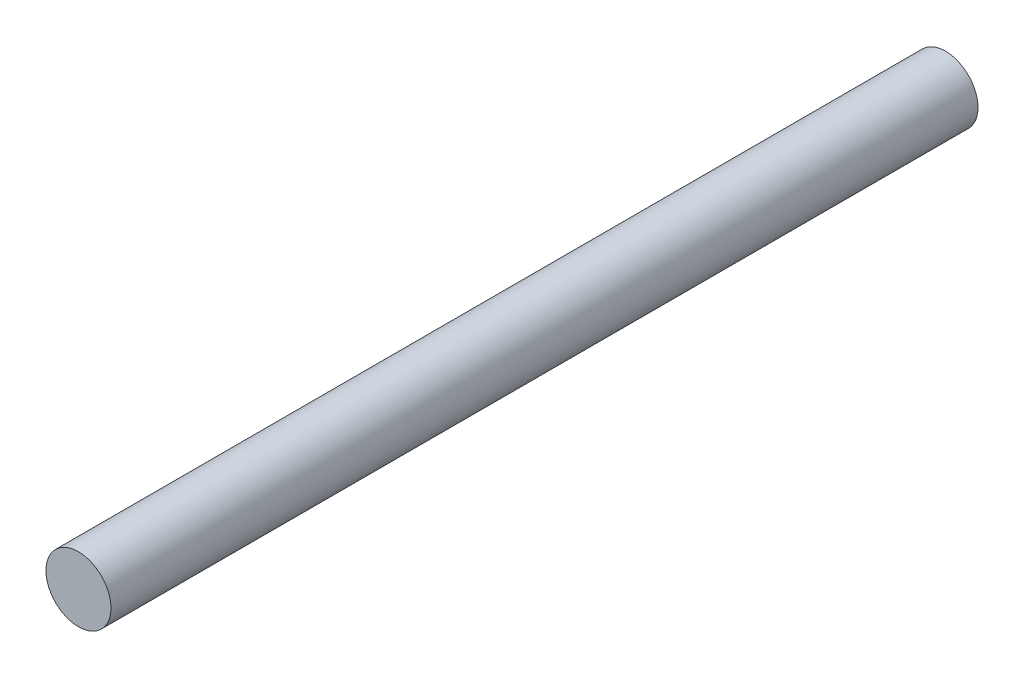
from build123d import *

# Parameters (mm, degrees)
SKETCH1_R           = 7.5
BOSS_EXTRUDE1_DEPTH = 200


with BuildPart() as part:
    # Sketch1 → Boss-Extrude1 (new body)
    with BuildSketch(Plane.XY):
        Circle(SKETCH1_R)
    extrude(amount=BOSS_EXTRUDE1_DEPTH)


solid = part.part
